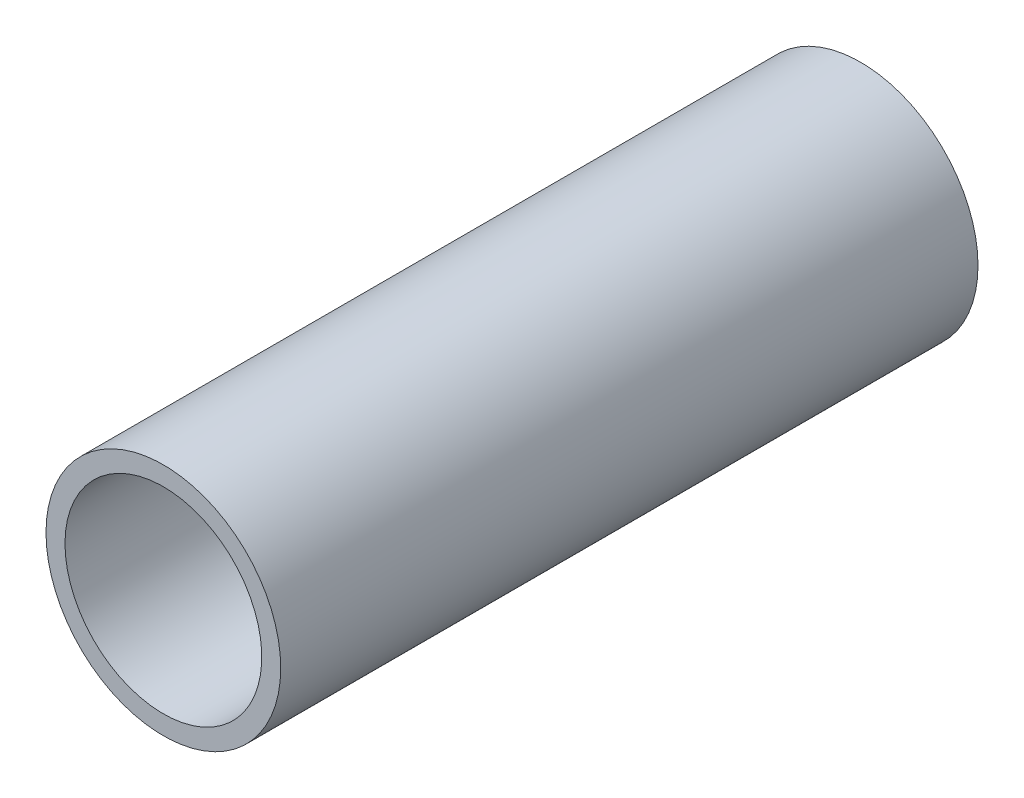
from build123d import *

# Parameters (mm, degrees)
SKETCH1_R           = 30.3
SKETCH1_R_2         = 25.4
BOSS_EXTRUDE1_DEPTH = 180


with BuildPart() as part:
    # Sketch1 → Boss-Extrude1 (new body)
    with BuildSketch(Plane.XY):
        with Locations(Location((0, 0, 0), (0, 0, 180))):
            Circle(SKETCH1_R)
        with Locations(Location((0, 0, 0), (0, 0, 180))):
            Circle(SKETCH1_R_2, mode=Mode.SUBTRACT)
    extrude(amount=BOSS_EXTRUDE1_DEPTH)


solid = part.part
